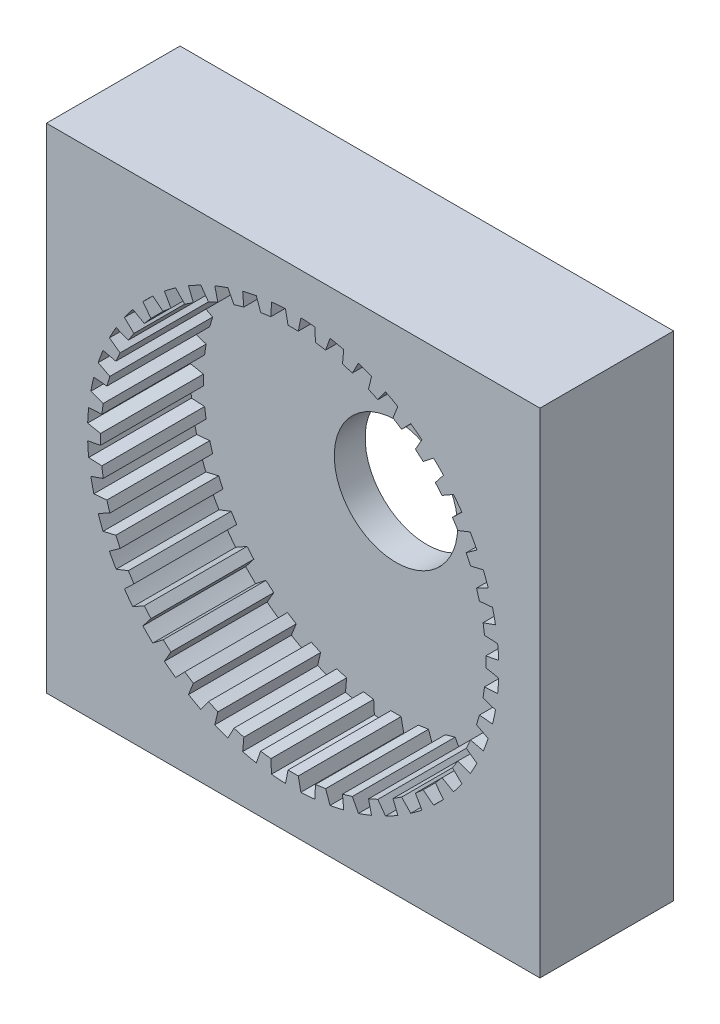
from build123d import *

# Parameters (mm, degrees)
SKETCH2_W           = 48
SKETCH2_H           = 48
SKETCH2_R           = 6
BOSS_EXTRUDE2_DEPTH = 3
SKETCH3_W           = 48
SKETCH3_H           = 48
SKETCH3_R           = 20
BOSS_EXTRUDE3_DEPTH = 10
BOSS_EXTRUDE6_DEPTH = 10


with BuildPart() as part:
    # Sketch2 → Boss-Extrude2 (new body)
    with BuildSketch(Plane.XY):
        with Locations((24, 24)):
            Rectangle(SKETCH2_W, SKETCH2_H)
        with Locations((24, 24)):
            Circle(SKETCH2_R, mode=Mode.SUBTRACT)
    extrude(amount=BOSS_EXTRUDE2_DEPTH)

    # Sketch3 → Boss-Extrude3 (add)
    with BuildSketch(Plane.XY.offset(3)):
        with Locations((24, 24)):
            Rectangle(SKETCH3_W, SKETCH3_H)
        with Locations((24, 24)):
            Circle(SKETCH3_R, mode=Mode.SUBTRACT)
    extrude(amount=BOSS_EXTRUDE3_DEPTH)

    # Sketch4 → Boss-Extrude6 (add)
    with BuildSketch(Plane.XY.offset(13)):
        Polygon((23.5, 42.731833473), (24.5, 42.731833473), (24.75, 44), (23.25, 44), align=None)
        Polygon((26.103930684, 43.903164966), (26.17090713, 42.612327837), (27.160728572, 42.470012998), (27.588662847, 43.689692709), align=None)
        Polygon((28.915031407, 43.40115889), (28.797620852, 42.113928879), (29.757113826, 41.832196322), (30.354270867, 42.978560055), align=None)
        Polygon((31.626076264, 42.504201167), (31.326668848, 41.246782565), (32.236300844, 40.831367552), (32.990524257, 41.881078647), align=None)
        Polygon((34.181876199, 41.23055127), (33.706566995, 40.028541494), (34.547820528, 39.487900677), (35.443756499, 40.419590044), align=None)
        Polygon((36.530402498, 39.606137038), (35.888867429, 38.484005541), (36.644617004, 37.829144807), (37.66402686, 38.623845937), align=None)
        Polygon((38.623845937, 37.66402686), (37.829144807, 36.644617004), (38.484005541, 35.888867429), (39.606137038, 36.530402498), align=None)
        Polygon((40.419590044, 35.443756499), (39.487900677, 34.547820528), (40.028541494, 33.706566995), (41.23055127, 34.181876199), align=None)
        Polygon((41.881078647, 32.990524257), (40.831367552, 32.236300844), (41.246782565, 31.326668848), (42.504201167, 31.626076264), align=None)
        Polygon((42.978560055, 30.354270867), (41.832196322, 29.757113826), (42.113928879, 28.797620852), (43.40115889, 28.915031407), align=None)
        Polygon((43.689692709, 27.588662847), (42.470012998, 27.160728572), (42.612327837, 26.17090713), (43.903164966, 26.103930684), align=None)
        Polygon((44, 24.75), (42.731833473, 24.5), (42.731833473, 23.5), (44, 23.25), align=None)
        Polygon((43.903164966, 21.896069316), (42.612327837, 21.82909287), (42.470012998, 20.839271428), (43.689692709, 20.411337153), align=None)
        Polygon((43.40115889, 19.084968593), (42.113928879, 19.202379148), (41.832196322, 18.242886174), (42.978560055, 17.645729133), align=None)
        Polygon((42.504201167, 16.373923736), (41.246782565, 16.673331152), (40.831367552, 15.763699156), (41.881078647, 15.009475743), align=None)
        Polygon((41.23055127, 13.818123801), (40.028541494, 14.293433005), (39.487900677, 13.452179472), (40.419590044, 12.556243501), align=None)
        Polygon((39.606137038, 11.469597502), (38.484005541, 12.111132571), (37.829144807, 11.355382996), (38.623845937, 10.33597314), align=None)
        Polygon((37.66402686, 9.376154063), (36.644617004, 10.170855193), (35.888867429, 9.515994459), (36.530402498, 8.393862962), align=None)
        Polygon((35.443756499, 7.580409956), (34.547820528, 8.512099323), (33.706566995, 7.971458506), (34.181876199, 6.76944873), align=None)
        Polygon((32.990524257, 6.118921353), (32.236300844, 7.168632448), (31.326668848, 6.753217435), (31.626076264, 5.495798833), align=None)
        Polygon((30.354270867, 5.021439945), (29.757113826, 6.167803678), (28.797620852, 5.886071121), (28.915031407, 4.59884111), align=None)
        Polygon((27.588662847, 4.310307291), (27.160728572, 5.529987002), (26.17090713, 5.387672163), (26.103930684, 4.096835034), align=None)
        Polygon((24.75, 4), (24.5, 5.268166527), (23.5, 5.268166527), (23.25, 4), align=None)
        Polygon((21.896069316, 4.096835034), (21.82909287, 5.387672163), (20.839271428, 5.529987002), (20.411337153, 4.310307291), align=None)
        Polygon((19.084968593, 4.59884111), (19.202379148, 5.886071121), (18.242886174, 6.167803678), (17.645729133, 5.021439945), align=None)
        Polygon((16.373923736, 5.495798833), (16.673331152, 6.753217435), (15.763699156, 7.168632448), (15.009475743, 6.118921353), align=None)
        Polygon((13.818123801, 6.76944873), (14.293433005, 7.971458506), (13.452179472, 8.512099323), (12.556243501, 7.580409956), align=None)
        Polygon((11.469597502, 8.393862962), (12.111132571, 9.515994459), (11.355382996, 10.170855193), (10.33597314, 9.376154063), align=None)
        Polygon((9.376154063, 10.33597314), (10.170855193, 11.355382996), (9.515994459, 12.111132571), (8.393862962, 11.469597502), align=None)
        Polygon((7.580409956, 12.556243501), (8.512099323, 13.452179472), (7.971458506, 14.293433005), (6.76944873, 13.818123801), align=None)
        Polygon((6.118921353, 15.009475743), (7.168632448, 15.763699156), (6.753217435, 16.673331152), (5.495798833, 16.373923736), align=None)
        Polygon((5.021439945, 17.645729133), (6.167803678, 18.242886174), (5.886071121, 19.202379148), (4.59884111, 19.084968593), align=None)
        Polygon((4.310307291, 20.411337153), (5.529987002, 20.839271428), (5.387672163, 21.82909287), (4.096835034, 21.896069316), align=None)
        Polygon((4, 23.25), (5.268166527, 23.5), (5.268166527, 24.5), (4, 24.75), align=None)
        Polygon((4.096835034, 26.103930684), (5.387672163, 26.17090713), (5.529987002, 27.160728572), (4.310307291, 27.588662847), align=None)
        Polygon((4.59884111, 28.915031407), (5.886071121, 28.797620852), (6.167803678, 29.757113826), (5.021439945, 30.354270867), align=None)
        Polygon((5.495798833, 31.626076264), (6.753217435, 31.326668848), (7.168632448, 32.236300844), (6.118921353, 32.990524257), align=None)
        Polygon((6.76944873, 34.181876199), (7.971458506, 33.706566995), (8.512099323, 34.547820528), (7.580409956, 35.443756499), align=None)
        Polygon((8.393862962, 36.530402498), (9.515994459, 35.888867429), (10.170855193, 36.644617004), (9.376154063, 37.66402686), align=None)
        Polygon((10.33597314, 38.623845937), (11.355382996, 37.829144807), (12.111132571, 38.484005541), (11.469597502, 39.606137038), align=None)
        Polygon((12.556243501, 40.419590044), (13.452179472, 39.487900677), (14.293433005, 40.028541494), (13.818123801, 41.23055127), align=None)
        Polygon((15.009475743, 41.881078647), (15.763699156, 40.831367552), (16.673331152, 41.246782565), (16.373923736, 42.504201167), align=None)
        Polygon((17.645729133, 42.978560055), (18.242886174, 41.832196322), (19.202379148, 42.113928879), (19.084968593, 43.40115889), align=None)
        Polygon((20.411337153, 43.689692709), (20.839271428, 42.470012998), (21.82909287, 42.612327837), (21.896069316, 43.903164966), align=None)
    extrude(amount=-BOSS_EXTRUDE6_DEPTH)


solid = part.part
